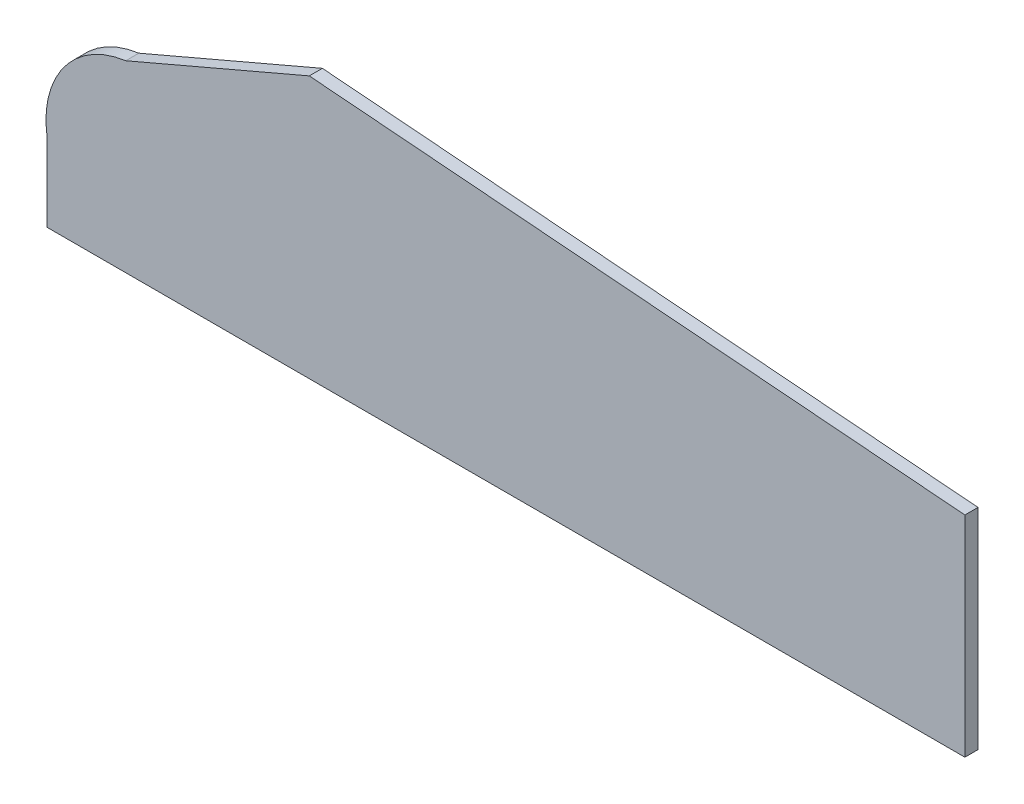
from build123d import *

# Parameters (mm, degrees)
BOSS_EXTRU_1_DEPTH = 5


with BuildPart() as part:
    # Esquisse1 → Boss.-Extru.1 (new body)
    with BuildSketch(Plane.XY):
        with BuildLine():
            Line((0, 0), (350, 0))
            Line((350, 0), (350, 80))
            Line((350, 80), (100, 100))
            Line((100, 100), (30, 70))
            ThreePointArc((30, 70), (6.595917942, 56.303061543), (0, 30))
            Line((0, 30), (0, 0))
        make_face()
    extrude(amount=BOSS_EXTRU_1_DEPTH)


solid = part.part
